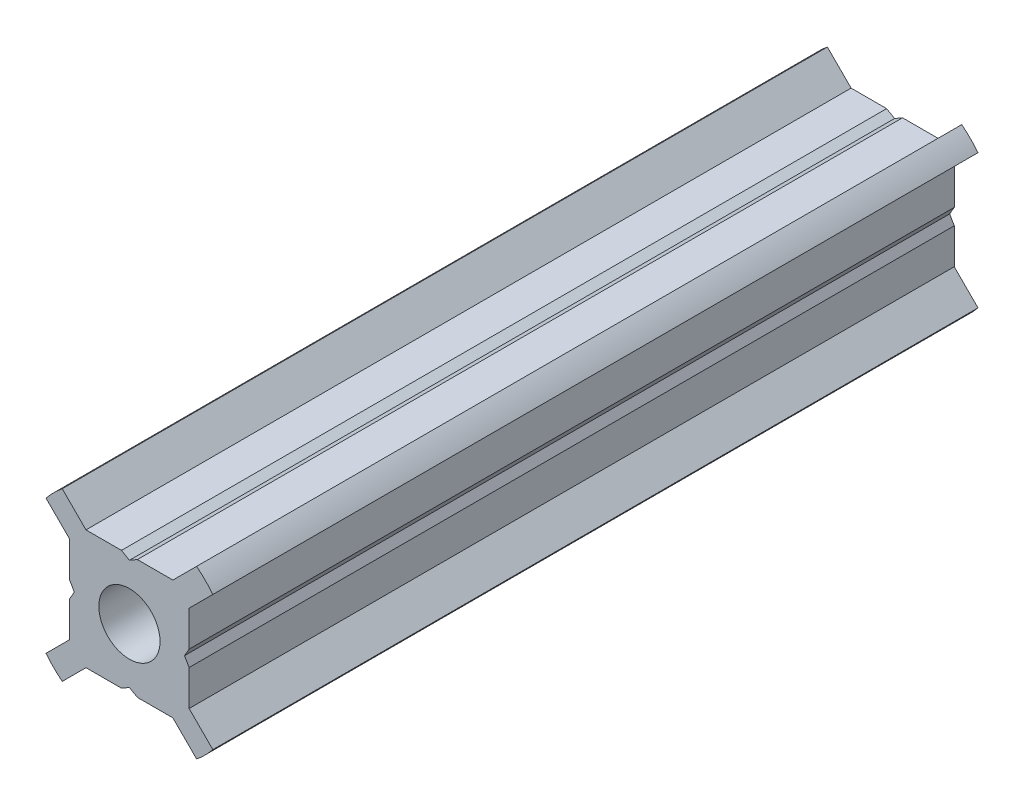
from build123d import *

# Parameters (mm, degrees)
SKETCH1_R           = 2
BOSS_EXTRUDE1_DEPTH = 50


with BuildPart() as part:
    # Sketch1 → Boss-Extrude1 (new body)
    with BuildSketch(Plane.XY):
        with BuildLine():
            Line((3.9, 2.839339828), (5.451585007, 4.390924835))
            ThreePointArc((5.451585007, 4.390924835), (4.949747468, 4.949747468), (4.390924835, 5.451585007))
            Line((4.390924835, 5.451585007), (2.839339828, 3.9))
            Line((2.839339828, 3.9), (0.519615242, 3.9))
            Line((0.519615242, 3.9), (0, 3.6))
            Line((0, 3.6), (-0.519615242, 3.9))
            Line((-0.519615242, 3.9), (-2.839339828, 3.9))
            Line((-2.839339828, 3.9), (-4.390924835, 5.451585007))
            ThreePointArc((-4.390924835, 5.451585007), (-4.949747468, 4.949747468), (-5.451585007, 4.390924835))
            Line((-5.451585007, 4.390924835), (-3.9, 2.839339828))
            Line((-3.9, 2.839339828), (-3.9, 0.519615242))
            Line((-3.9, 0.519615242), (-3.6, 0))
            Line((-3.6, 0), (-3.9, -0.519615242))
            Line((-3.9, -0.519615242), (-3.9, -2.839339828))
            Line((-3.9, -2.839339828), (-5.451585007, -4.390924835))
            ThreePointArc((-5.451585007, -4.390924835), (-4.949747468, -4.949747468), (-4.390924835, -5.451585007))
            Line((-4.390924835, -5.451585007), (-2.839339828, -3.9))
            Line((-2.839339828, -3.9), (-0.519615242, -3.9))
            Line((-0.519615242, -3.9), (0, -3.6))
            Line((0, -3.6), (0.519615242, -3.9))
            Line((0.519615242, -3.9), (2.839339828, -3.9))
            Line((2.839339828, -3.9), (4.390924835, -5.451585007))
            ThreePointArc((4.390924835, -5.451585007), (4.949747468, -4.949747468), (5.451585007, -4.390924835))
            Line((5.451585007, -4.390924835), (3.9, -2.839339828))
            Line((3.9, -2.839339828), (3.9, -0.519615242))
            Line((3.9, -0.519615242), (3.6, 0))
            Line((3.6, 0), (3.9, 0.519615242))
            Line((3.9, 0.519615242), (3.9, 2.839339828))
        make_face()
        Circle(SKETCH1_R, mode=Mode.SUBTRACT)
    extrude(amount=BOSS_EXTRUDE1_DEPTH)


solid = part.part
